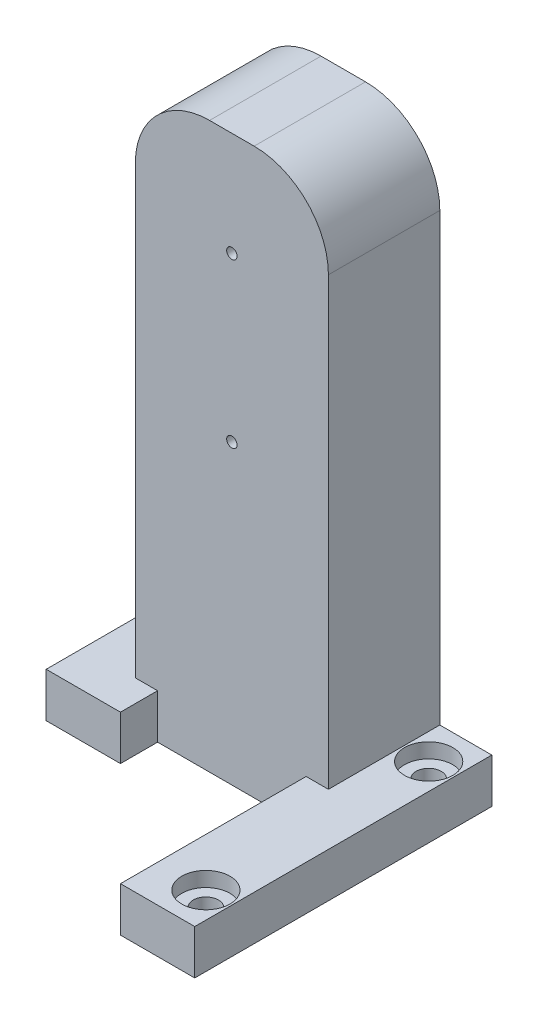
from build123d import *

# Parameters (mm, degrees)
BOSS_EXTRU_1_DEPTH                                   = 15
ESQUISSE2_W                                          = 10
ESQUISSE2_H                                          = 25
ESQUISSE2_H_2                                        = 5
BOSS_EXTRU_2_DEPTH                                   = 6
D_GAGEMENT_M1_21_D                                   = 1.4
CHAMBRAGE_POUR_T_TE_CYLINDRIQUE_FENDUE_M_D           = 3.4
CHAMBRAGE_POUR_T_TE_CYLINDRIQUE_FENDUE_M_CBORE_D     = 6.5
CHAMBRAGE_POUR_T_TE_CYLINDRIQUE_FENDUE_M_CBORE_DEPTH = 2
CONG_1_R                                             = 10


with BuildPart() as part:
    # Esquisse1 → Boss.-Extru.1 (new body)
    with BuildSketch(Plane.XY):
        Polygon((0, 0), (-20, 0), (-20, 6), (-13, 6), (-13, 76), (13, 76), (13, 6), (20, 6), (20, 0), align=None)
    extrude(amount=BOSS_EXTRU_1_DEPTH)

    # Esquisse2 → Boss.-Extru.2 (add)
    with BuildSketch(Plane.XZ):
        with Locations((15, 27.5)):
            Rectangle(ESQUISSE2_W, ESQUISSE2_H)
        with Locations((-15, 17.5)):
            Rectangle(ESQUISSE2_W, ESQUISSE2_H_2)
    extrude(amount=-BOSS_EXTRU_2_DEPTH)

    # Dégagement M1.21 (through all)
    with Locations(Plane.XY.offset(15)):
        with Locations((0, 62), (0, 40)):
            Hole(D_GAGEMENT_M1_21_D / 2)

    # Chambrage pour tête cylindrique fendue M31 (through all)
    with Locations(Plane(origin=(0, 6, 0), x_dir=(1, 0, 0), z_dir=(0, 1, 0))):
        with Locations((-16.5, -5), (16.5, -5), (16.5, -35)):
            CounterBoreHole(CHAMBRAGE_POUR_T_TE_CYLINDRIQUE_FENDUE_M_D / 2, CHAMBRAGE_POUR_T_TE_CYLINDRIQUE_FENDUE_M_CBORE_D / 2, CHAMBRAGE_POUR_T_TE_CYLINDRIQUE_FENDUE_M_CBORE_DEPTH)

    # Congé1
    cong_1_edges = [part.edges().sort_by_distance(p)[0] for p in [
        (-13, 76, 7.5),
        (13, 76, 7.5),
    ]]
    fillet(cong_1_edges, radius=CONG_1_R)


solid = part.part
